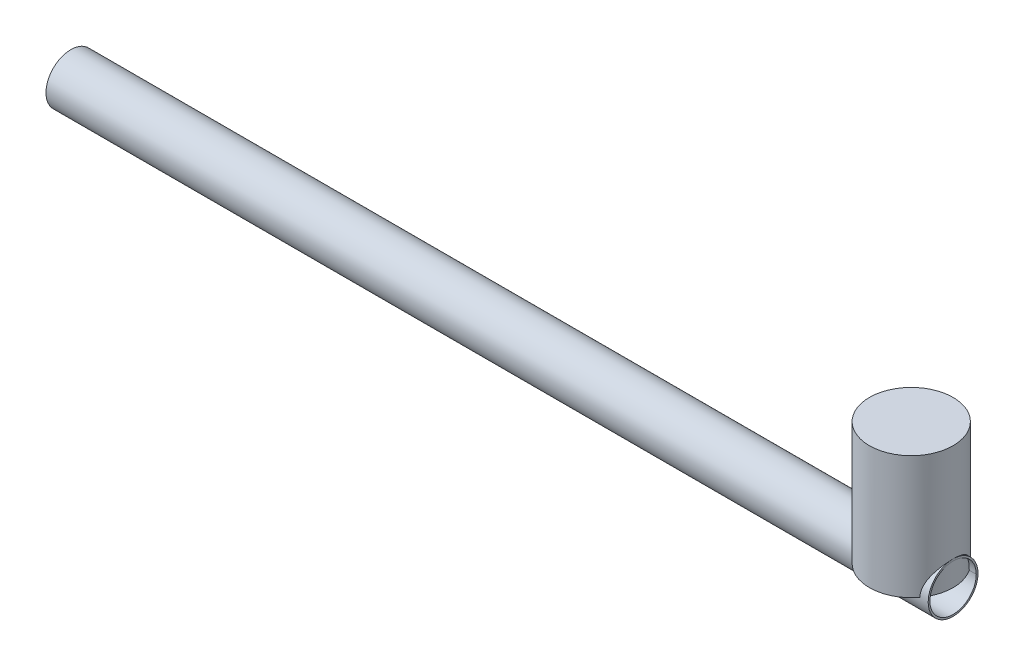
from build123d import *

# Parameters (mm, degrees)
SKETCH1_R           = 12.7
SKETCH1_R_2         = 11.811
BOSS_EXTRUDE1_DEPTH = 449.838
SKETCH2_R           = 21.33128873
BOSS_EXTRUDE2_DEPTH = 62.7


with BuildPart() as part:
    # Sketch1 → Boss-Extrude1 (new body)
    with BuildSketch(Plane(origin=(0, 0, 0), x_dir=(0, 0, -1), z_dir=(1, 0, 0))):
        Circle(SKETCH1_R)
        Circle(SKETCH1_R_2, mode=Mode.SUBTRACT)
    extrude(amount=BOSS_EXTRUDE1_DEPTH)

    # Sketch2 → Boss-Extrude2 (add)
    with BuildSketch(Plane(origin=(0, 0, 0), x_dir=(1, 0, 0), z_dir=(0, 1, 0))):
        with Locations(Location((428.50671127, 0, 0), (0, 0, 143.461018273))):
            Circle(SKETCH2_R)
    extrude(amount=BOSS_EXTRUDE2_DEPTH)


solid = part.part
